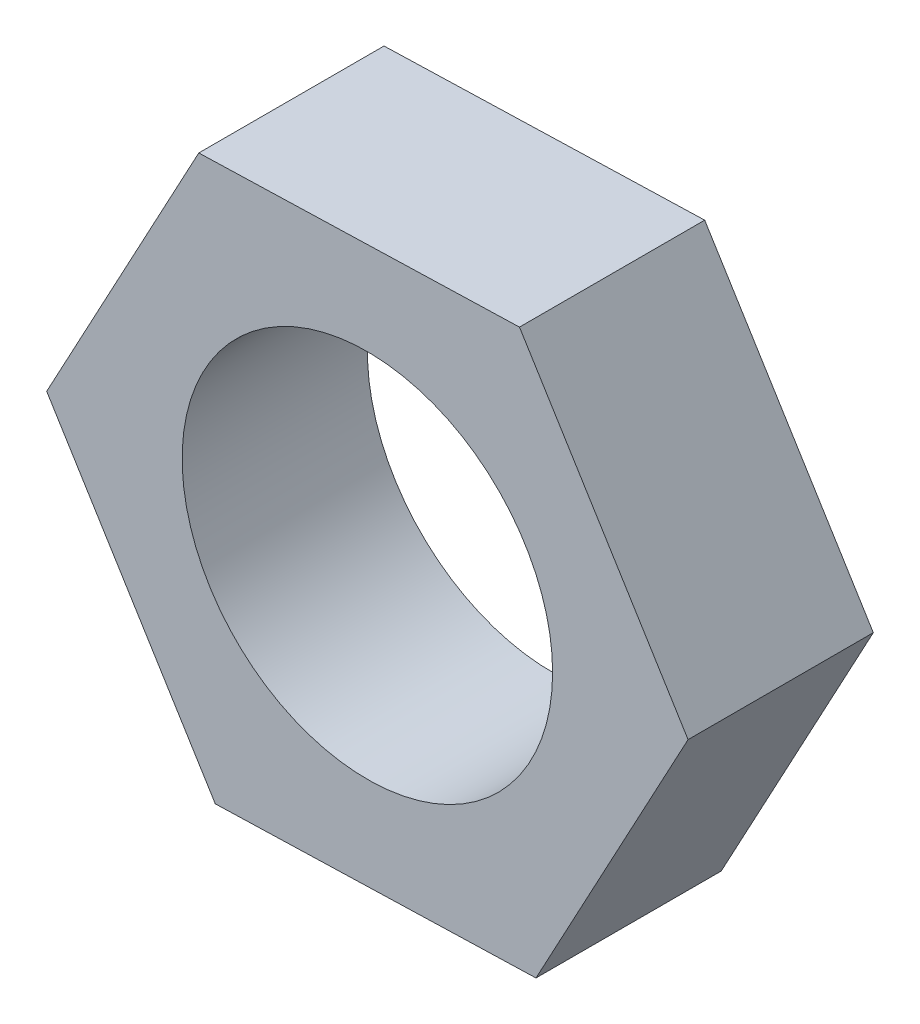
from build123d import *

# Parameters (mm, degrees)
SKETCH1_R           = 5
BOSS_EXTRUDE2_DEPTH = 5


with BuildPart() as part:
    # Sketch1 → Boss-Extrude2 (new body)
    with BuildSketch(Plane.XY):
        Polygon((4.550901842, -7.368126792), (8.656435901, 0.257133209), (4.105534059, 7.625260001), (-4.550901842, 7.368126792), (-8.656435901, -0.257133209), (-4.105534059, -7.625260001), align=None)
        Circle(SKETCH1_R, mode=Mode.SUBTRACT)
    extrude(amount=BOSS_EXTRUDE2_DEPTH)


solid = part.part
